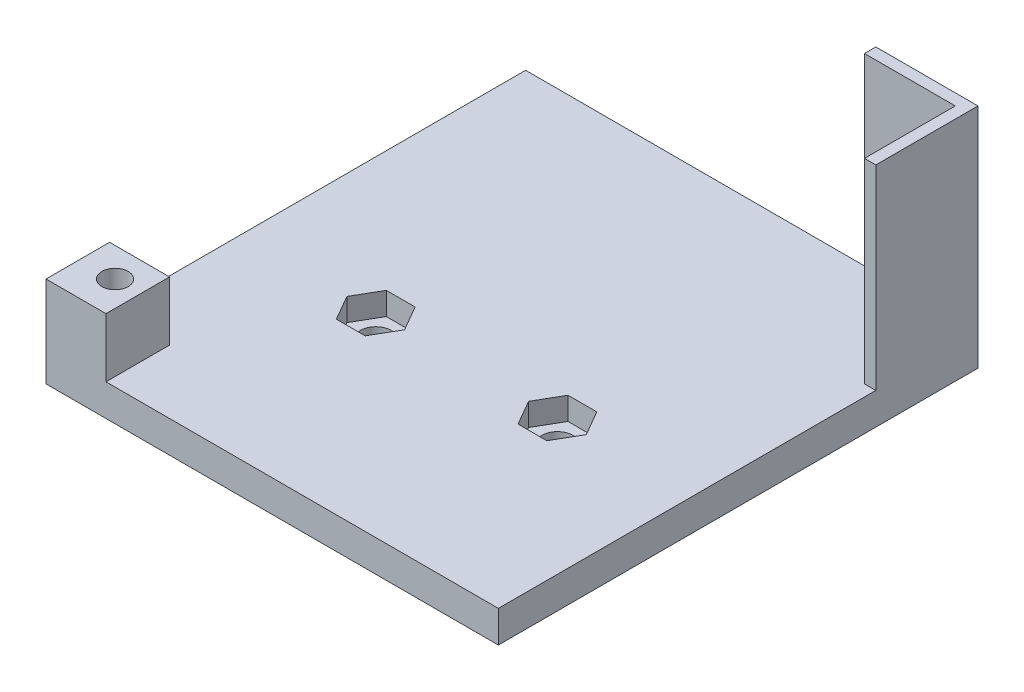
from build123d import *

# Parameters (mm, degrees)
BOSS_EXTRUDE1_DEPTH = 3.5
BOSS_EXTRUDE2_DEPTH = 25
SKETCH1_5_W         = 6.602272727
SKETCH1_5_H         = 7
BOSS_EXTRUDE3_DEPTH = 10
SKETCH3_R           = 1.45
CUT_EXTRUDE1_DEPTH  = 40.267925843
SKETCH4_R           = 1.7
CUT_EXTRUDE2_DEPTH  = 43.18080132
SKETCH4_3_R         = 1.7
CUT_EXTRUDE3_DEPTH  = 2.5


with BuildPart() as part:
    # Sketch1 → Boss-Extrude1 (new body)
    with BuildSketch(Plane(origin=(0, 0, 0), x_dir=(1, 0, 0), z_dir=(0, 1, 0))):
        Polygon((13.65, 25.15), (13.65, 26.4), (-24.9, 26.4), (-24.9, -19.4), (-18.297727273, -19.4), (-18.297727273, -26.4), (24.9, -26.4), (24.9, 15.15), (23.65, 15.15), (23.65, 25.15), align=None)
    extrude(amount=BOSS_EXTRUDE1_DEPTH)

    # Sketch1<4> → Boss-Extrude2 (add)
    with BuildSketch(Plane(origin=(0, 0, 0), x_dir=(1, 0, 0), z_dir=(0, 1, 0))):
        Polygon((24.9, 26.4), (13.65, 26.4), (13.65, 25.15), (23.65, 25.15), (23.65, 15.15), (24.9, 15.15), align=None)
    extrude(amount=BOSS_EXTRUDE2_DEPTH)

    # Sketch1<5> → Boss-Extrude3 (add)
    with BuildSketch(Plane(origin=(0, 0, 0), x_dir=(1, 0, 0), z_dir=(0, 1, 0))):
        with Locations((-21.598863636, -22.9)):
            Rectangle(SKETCH1_5_W, SKETCH1_5_H)
    extrude(amount=BOSS_EXTRUDE3_DEPTH)

    # Sketch3 → Cut-Extrude1 (cut, through all)
    with BuildSketch(Plane(origin=(0, 10, 0), x_dir=(1, 0, 0), z_dir=(0, 1, 0))):
        with Locations((-21.1, -22.6)):
            Circle(SKETCH3_R)
    extrude(amount=-CUT_EXTRUDE1_DEPTH, mode=Mode.SUBTRACT)

    # Sketch4 → Cut-Extrude2 (cut, through all)
    with BuildSketch(Plane(origin=(0, 3.5, 0), x_dir=(1, 0, 0), z_dir=(0, 1, 0))):
        with Locations((-10, -5)):
            Circle(SKETCH4_R)
        with Locations((10, -5)):
            Circle(SKETCH4_R)
    extrude(amount=-CUT_EXTRUDE2_DEPTH, mode=Mode.SUBTRACT)

    # Sketch4<3> → Cut-Extrude3 (cut)
    # profile 1 of 2: a face of its own
    with BuildSketch(Plane(origin=(0, 3.5, 0), x_dir=(1, 0, 0), z_dir=(0, 1, 0))):
        Polygon((-6.824573519, -5), (-8.41228676, -2.25), (-11.58771324, -2.25), (-13.175426481, -5), (-11.58771324, -7.75), (-8.41228676, -7.75), align=None)
        with Locations((-10, -5)):
            Circle(SKETCH4_3_R, mode=Mode.SUBTRACT)
    # profile 2 of 2: a face of its own
    with BuildSketch(Plane(origin=(0, 3.5, 0), x_dir=(1, 0, 0), z_dir=(0, 1, 0))):
        Polygon((13.175426481, -5), (11.58771324, -2.25), (8.41228676, -2.25), (6.824573519, -5), (8.41228676, -7.75), (11.58771324, -7.75), align=None)
        with Locations((10, -5)):
            Circle(SKETCH4_3_R, mode=Mode.SUBTRACT)
    extrude(amount=-CUT_EXTRUDE3_DEPTH, mode=Mode.SUBTRACT)


solid = part.part
